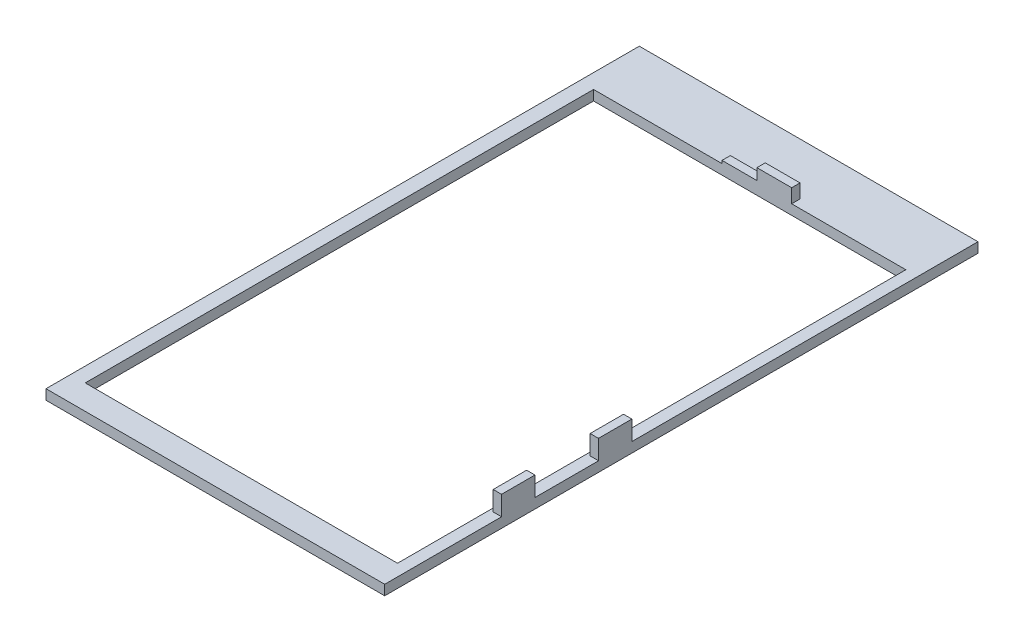
from build123d import *

# Parameters (mm, degrees)
SKETCH1_W           = 56.06
SKETCH1_H           = 91.25
BOSS_EXTRUDE1_DEPTH = 1.8
BOSS_EXTRUDE2_DEPTH = 1.5
BOSS_EXTRUDE3_DEPTH = 1.5


with BuildPart() as part:
    # Sketch1 → Boss-Extrude1 (new body)
    # profile 1 of 2: a face of its own
    with BuildSketch(Plane(origin=(0, 0, 0), x_dir=(1, 0, 0), z_dir=(0, 1, 0))):
        Polygon((-30.193578772, 16.86607096), (30.606421228, 16.86607096), (30.606421228, -89.63392904), (-0.343578772, -89.63392904), (-30.193578772, -89.63392904), align=None)
        Polygon((-28.695861914, -88.133930777), (-28.695861914, 15.366069223), (29.104138086, 15.366069223), (29.104138086, -88.133930777), (-0.345861914, -88.133930777), align=None, mode=Mode.SUBTRACT)
    # profile 2 of 2: a face of its own
    with BuildSketch(Plane(origin=(0, 0, 0), x_dir=(1, 0, 0), z_dir=(0, 1, 0))):
        Polygon((-28.695861914, -88.133930777), (-0.345861914, -88.133930777), (29.104138086, -88.133930777), (29.104138086, 15.366069223), (-28.695861914, 15.366069223), align=None)
        with Locations((0.456421228, -39.58892904)):
            Rectangle(SKETCH1_W, SKETCH1_H, mode=Mode.SUBTRACT)
    extrude(amount=BOSS_EXTRUDE1_DEPTH)

    # Sketch4 → Boss-Extrude2 (add)
    with BuildSketch(Plane.XY.offset(-6.03607096)):
        Polygon((7.986421228, 1.8), (7.986421228, 4.3), (1.749686336, 4.3), (1.749686336, 2.3), (-4.513578772, 2.3), (-4.501292732, 1.8), (1.749686336, 1.8), align=None)
    extrude(amount=-BOSS_EXTRUDE2_DEPTH)

    # Sketch5 → Boss-Extrude3 (add)
    with BuildSketch(Plane(origin=(30.606421228, 0, 0), x_dir=(0, 0, -1), z_dir=(1, 0, 0))):
        Polygon((-68.657420773, 1.8), (-68.66392904, 5.3), (-62.66392904, 5.3), (-62.66392904, 1.8), align=None)
        Polygon((-51.24372118, 1.8), (-51.26392904, 5.3), (-45.26392904, 5.3), (-45.26392904, 1.8), align=None)
    extrude(amount=-BOSS_EXTRUDE3_DEPTH)


solid = part.part
